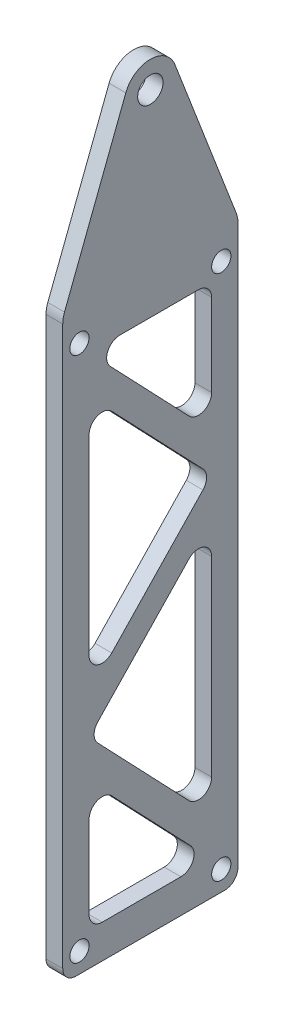
from build123d import *

# Parameters (mm, degrees)
SKETCH1_W           = 41.514809608
SKETCH1_H           = 98.81
SKETCH1_R           = 1.8288
SKETCH1_R_2         = 2.413
BOSS_EXTRUDE1_DEPTH = 3.175
SKETCH2_W           = 4.112404804
SKETCH2_H           = 141.223
CUT_EXTRUDE1_DEPTH  = 106.912542124
FILLET1_R           = 2.5
FILLET2_R           = 5


with BuildPart() as part:
    # Sketch1 → Boss-Extrude1 (new body)
    # profile 1 of 2: a face of its own
    with BuildSketch(Plane(origin=(0, 0, 0), x_dir=(0, 0, -1), z_dir=(1, 0, 0))):
        with Locations((0, -54.405)):
            Rectangle(SKETCH1_W, SKETCH1_H)
        with Locations((13.4747, -100)):
            Circle(SKETCH1_R, mode=Mode.SUBTRACT)
        with Locations((-13.4747, -100)):
            Circle(SKETCH1_R, mode=Mode.SUBTRACT)
    # profile 2 of 2: a face of its own
    with BuildSketch(Plane(origin=(0, 0, 0), x_dir=(0, 0, -1), z_dir=(1, 0, 0))):
        Polygon((0, 48.916537522), (20.757404804, -5), (-20.757404804, -5), align=None)
        with Locations((13.4747, 0)):
            Circle(SKETCH1_R, mode=Mode.SUBTRACT)
        with Locations((0, 35)):
            Circle(SKETCH1_R_2, mode=Mode.SUBTRACT)
        with Locations((-13.4747, 0)):
            Circle(SKETCH1_R, mode=Mode.SUBTRACT)
    extrude(amount=BOSS_EXTRUDE1_DEPTH)

    # Sketch2 → Cut-Extrude1 (cut, through all)
    with BuildSketch(Plane(origin=(3.175, 0, 0), x_dir=(0, 0, -1), z_dir=(1, 0, 0))):
        Polygon((11.645, -2.5), (-11.645, -2.5), (11.645, -26.898674048), align=None)
        Polygon((-11.645, -9.741325952), (11.645, -34.14), (-11.645, -58.538674048), (-11.645, -34.14), align=None)
        Polygon((-11.645, -73.021325952), (-11.645, -97.42), (11.645, -97.42), align=None)
        Polygon((11.645, -41.381325952), (11.645, -65.78), (11.645, -90.178674048), (-11.645, -65.78), align=None)
        with Locations((-18.701202402, -33.1985)):
            Rectangle(SKETCH2_W, SKETCH2_H)
        with Locations((18.701202402, -33.1985)):
            Rectangle(SKETCH2_W, SKETCH2_H)
    extrude(amount=-CUT_EXTRUDE1_DEPTH, mode=Mode.SUBTRACT)

    # Fillet1
    fillet1_edges = [part.edges().sort_by_distance(p)[0] for p in [
        (1.5875, -103.81, -16.645),
        (1.5875, -9.741325952, 11.645),
        (1.5875, -34.14, -11.645),
        (1.5875, -58.538674048, 11.645),
        (1.5875, -26.898674048, -11.645),
        (1.5875, -2.5, 11.645),
        (1.5875, -2.5, -11.645),
        (1.5875, -90.178674048, -11.645),
        (1.5875, -65.78, 11.645),
        (1.5875, -41.381325952, -11.645),
        (1.5875, -103.81, 16.645),
        (1.5875, -73.021325952, 11.645),
        (1.5875, -97.42, -11.645),
        (1.5875, -97.42, 11.645),
    ]]
    fillet(fillet1_edges, radius=FILLET1_R)

    # Fillet2
    fillet2_edges = [part.edges().sort_by_distance(p)[0] for p in [
        (1.5875, 48.916537522, 0),
        (1.5875, 5.681808734, -16.645),
        (1.5875, 5.681808734, 16.645),
    ]]
    fillet(fillet2_edges, radius=FILLET2_R)


solid = part.part
